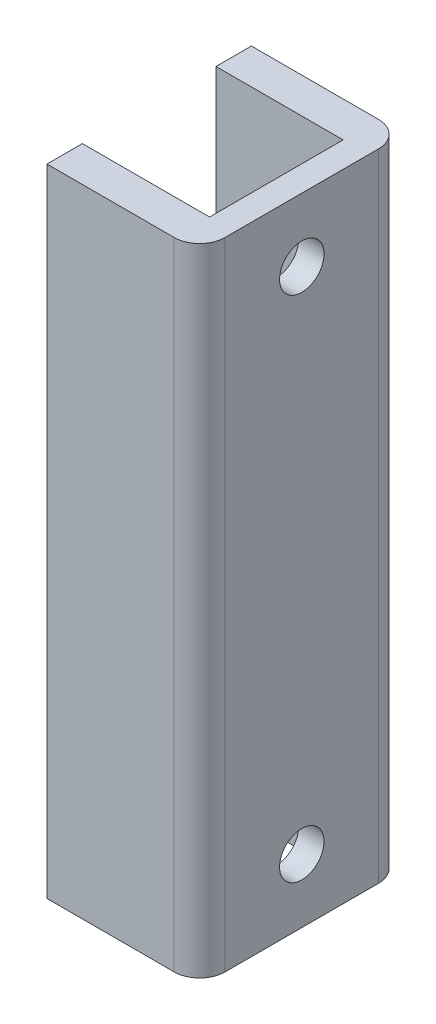
from build123d import *

# Parameters (mm, degrees)
EXTRUDE_1_DEPTH     = 50
SKETCH_2_R          = 1.75
CUT_EXTRUDE_1_DEPTH = 53.252813616


with BuildPart() as part:
    # 草图1 → 凸台-拉伸1 (new body)
    with BuildSketch(Plane(origin=(0, 0, 0), x_dir=(1, 0, 0), z_dir=(0, 1, 0))):
        with BuildLine():
            Line((-8.053167235, 9.292821463), (1.946832765, 9.292821463))
            ThreePointArc((1.946832765, 9.292821463), (3.361046328, 8.707035025), (3.946832765, 7.292821463))
            Line((3.946832765, 7.292821463), (3.946832765, -4.777178537))
            ThreePointArc((3.946832765, -4.777178537), (3.361046328, -6.191392099), (1.946832765, -6.777178537))
            Line((1.946832765, -6.777178537), (-8.053167235, -6.777178537))
            Line((-8.053167235, -6.777178537), (-8.053167235, -3.992178537))
            Line((-8.053167235, -3.992178537), (1.946832765, -3.992178537))
            Line((1.946832765, -3.992178537), (1.946832765, 6.507821463))
            Line((1.946832765, 6.507821463), (-8.053167235, 6.507821463))
            Line((-8.053167235, 6.507821463), (-8.053167235, 9.292821463))
        make_face()
    extrude(amount=EXTRUDE_1_DEPTH)

    # 草图2 → 切除-拉伸1 (cut, through all)
    with BuildSketch(Plane(origin=(3.946832765, 0, 0), x_dir=(0, 0, -1), z_dir=(1, 0, 0))):
        with Locations((1.257821463, 45)):
            Circle(SKETCH_2_R)
        with Locations((1.257821463, 5)):
            Circle(SKETCH_2_R)
    extrude(amount=-CUT_EXTRUDE_1_DEPTH, mode=Mode.SUBTRACT)


solid = part.part
